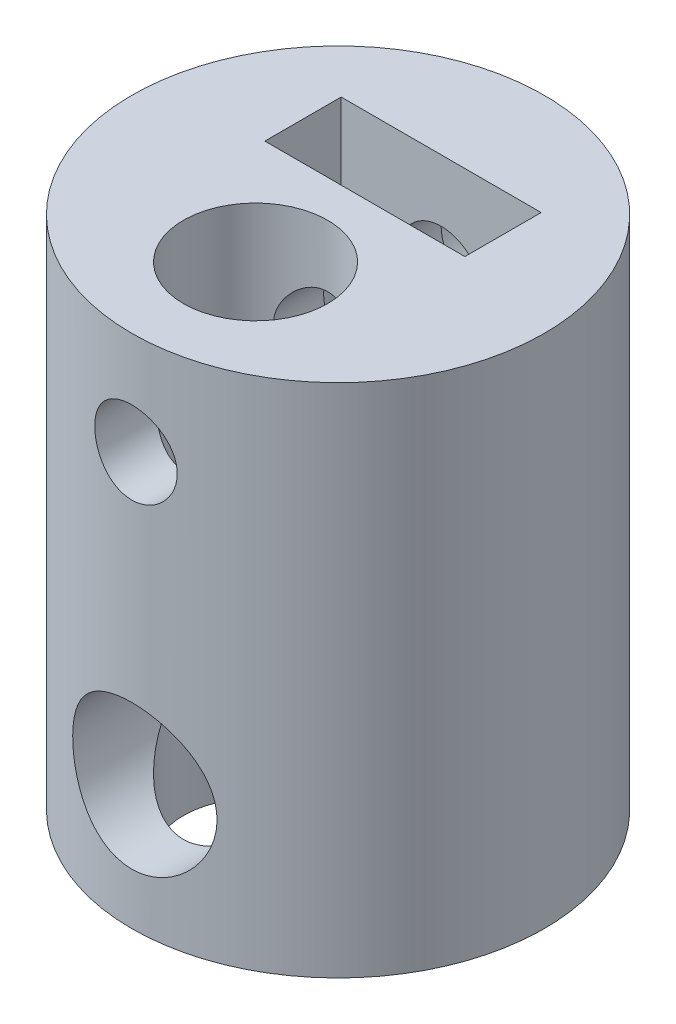
from build123d import *

# Parameters (mm, degrees)
CROQUIS1_R              = 10
SALIENTE_EXTRUIR1_DEPTH = 25
CORTAR_EXTRUIR1_REACH   = 30.723
CROQUIS3_R              = 3.5
CROQUIS5_R              = 3.5
CROQUIS5_R_2            = 2
CORTAR_EXTRUIR3_DEPTH   = 34.541019662
CORTAR_EXTRUIR4_REACH   = 30.723
CROQUIS6_W              = 9.7
CROQUIS6_H              = 3.7
CROQUIS7_R              = 3.5
CORTAR_EXTRUIR5_DEPTH   = 3


with BuildPart() as part:
    # Croquis1 → Saliente-Extruir1 (new body)
    with BuildSketch(Plane(origin=(0, 0, 0), x_dir=(1, 0, 0), z_dir=(0, 1, 0))):
        with Locations(Location((0, 0, 0), (0, 0, 270))):
            Circle(CROQUIS1_R)
    extrude(amount=SALIENTE_EXTRUIR1_DEPTH)

    # Croquis3 → Cortar-Extruir1 (cut, up to next)
    with BuildSketch(Plane(origin=(0, 25, 0), x_dir=(1, 0, 0), z_dir=(0, 1, 0)), mode=Mode.PRIVATE) as cortar_extruir1_sk1:
        with Locations(Location((0, -4, 0), (0, 0, 270))):
            Circle(CROQUIS3_R)
    cortar_extruir1_tool1 = extrude(cortar_extruir1_sk1.sketch, amount=-CORTAR_EXTRUIR1_REACH, mode=Mode.PRIVATE) & part.part
    add(cortar_extruir1_tool1.solids().sort_by_distance((0, 25, 4))[0], mode=Mode.SUBTRACT)

    # Croquis5 → Cortar-Extruir3 (cut, through all)
    with BuildSketch(Plane(origin=(0, 0, -10), x_dir=(-1, 0, 0), z_dir=(0, 0, -1))):
        with Locations((0, 6)):
            Circle(CROQUIS5_R)
        with Locations((0, 20)):
            Circle(CROQUIS5_R_2)
    extrude(amount=-CORTAR_EXTRUIR3_DEPTH, mode=Mode.SUBTRACT)

    # Croquis6 → Cortar-Extruir4 (cut, up to next)
    with BuildSketch(Plane.XZ, mode=Mode.PRIVATE) as cortar_extruir4_sk1:
        with Locations((0, -3.15)):
            Rectangle(CROQUIS6_W, CROQUIS6_H)
    cortar_extruir4_tool1 = extrude(cortar_extruir4_sk1.sketch, amount=-CORTAR_EXTRUIR4_REACH, mode=Mode.PRIVATE) & part.part
    add(cortar_extruir4_tool1.solids().sort_by_distance((0, 0, -3.15))[0], mode=Mode.SUBTRACT)

    # Croquis7 → Cortar-Extruir5 (cut)
    with BuildSketch(Plane(origin=(0, 0, -10), x_dir=(-1, 0, 0), z_dir=(0, 0, -1))):
        with Locations((0, 20)):
            Circle(CROQUIS7_R)
    extrude(amount=-CORTAR_EXTRUIR5_DEPTH, mode=Mode.SUBTRACT)


solid = part.part
